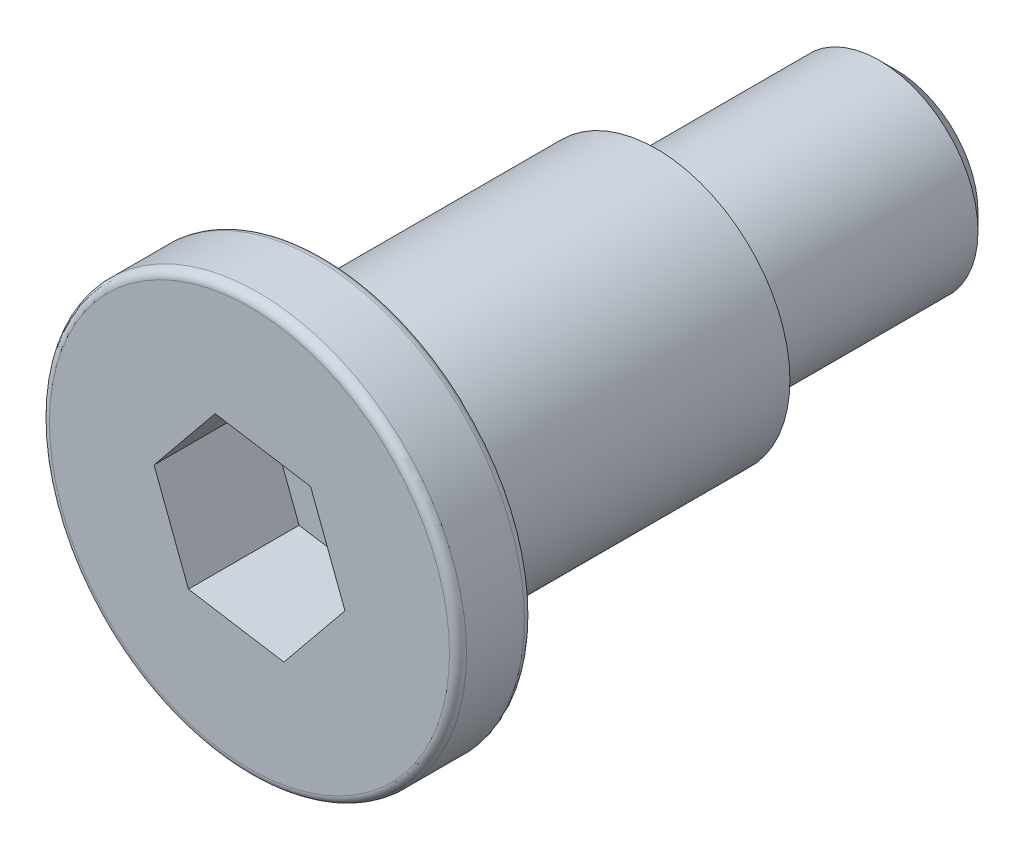
from build123d import *

# Parameters (mm, degrees)
CUT_EXTRUDE1_DEPTH = 1.651
FILLET1_R          = 0.127
CHAMFER1_SIZE      = 0.254
SCALE1_SCALE       = 0.6


with BuildPart() as part:
    # Sketch1 → Revolve1 (revolve)
    with BuildSketch(Plane(origin=(0, 0, 0), x_dir=(0, 0, -1), z_dir=(1, 0, 0)), mode=Mode.PRIVATE) as revolve1_sk:
        Polygon((0, 0), (9.652, 0), (9.652, 1.4732), (6.0706, 1.4732), (6.0706, 1.9939), (1.1176, 1.9939), (1.1176, 3.1115), (0, 3.1115), align=None)
    revolve(revolve1_sk.sketch.rotate(Axis((0, 0, 0), (0, 0, -1)), 90), axis=Axis((0, 0, 0), (0, 0, -1)))

    # Sketch2 → Cut-Extrude1 (cut)
    with BuildSketch(Plane.XY):
        Polygon((-0.911507965, -1.118668866), (0.513041674, -1.348723487), (1.424549639, -0.23005462), (0.911507965, 1.118668866), (-0.513041674, 1.348723487), (-1.424549639, 0.23005462), align=None)
    extrude(amount=-CUT_EXTRUDE1_DEPTH, mode=Mode.SUBTRACT)

    # Fillet1
    fillet1_edges = [part.edges().sort_by_distance(p)[0] for p in [
        (-3.1115, 0, 0),
        (-3.1115, 0, -1.1176),
    ]]
    fillet(fillet1_edges, radius=FILLET1_R)

    # Chamfer1
    chamfer1_edges = [part.edges().sort_by_distance(p)[0] for p in [
        (-1.4732, 0, -9.652),
    ]]
    chamfer(chamfer1_edges, length=CHAMFER1_SIZE)


with BuildPart() as part_1:
    # Scale1: scaled about (0, 0, -3.814782306)
    add(part.part.scale(SCALE1_SCALE).moved(Location((0, 0, -1.525912922))))


solid = part_1.part
